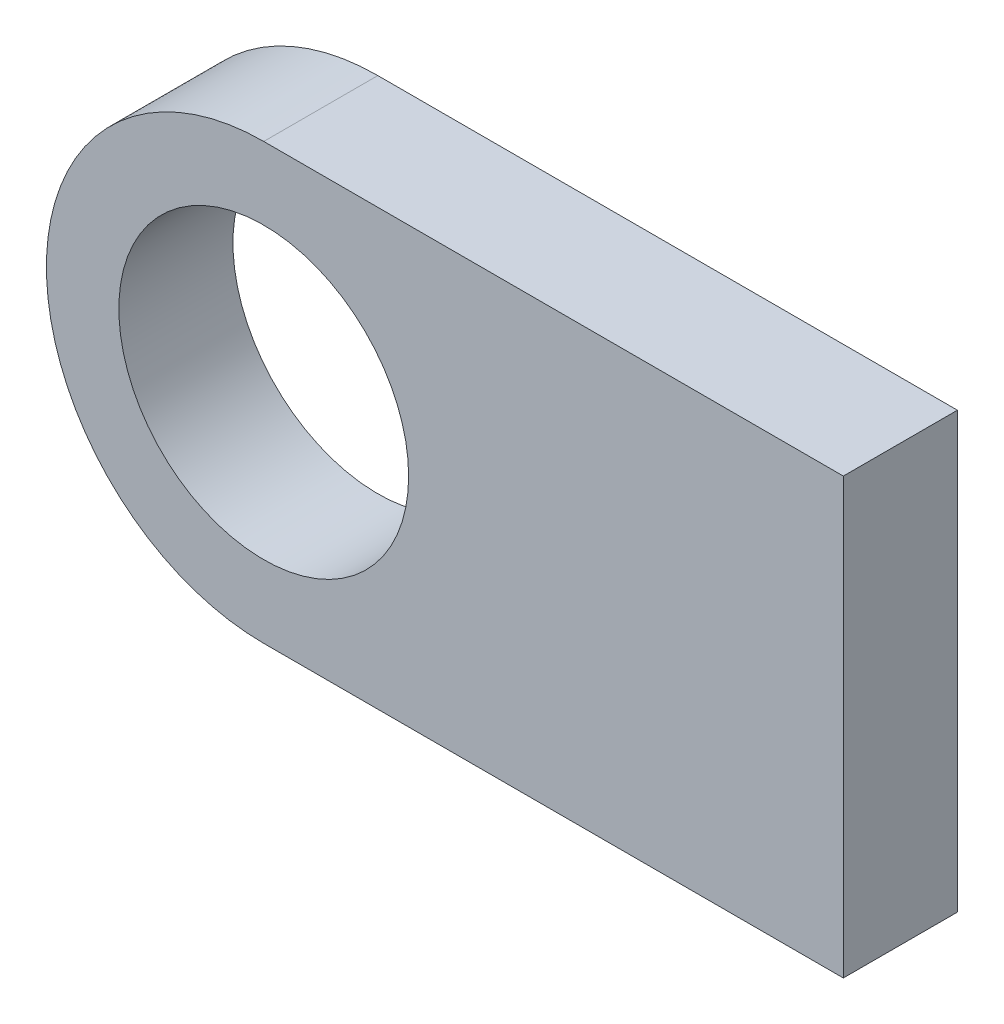
from build123d import *

# Parameters (mm, degrees)
SKETCH1_R      = 12.7
EXTRUDE1_DEPTH = 10.000000066


with BuildPart() as part:
    # Sketch1 → Extrude1 (new body)
    with BuildSketch(Plane.XY):
        with BuildLine():
            Line((0, 0), (50.8, 0))
            Line((50.8, 0), (50.8, 38.1))
            Line((50.8, 38.1), (0, 38.1))
            ThreePointArc((0, 38.1), (-19.05, 19.05), (0, 0))
        make_face()
        with Locations((0, 19.05)):
            Circle(SKETCH1_R, mode=Mode.SUBTRACT)
    extrude(amount=-EXTRUDE1_DEPTH)


solid = part.part
